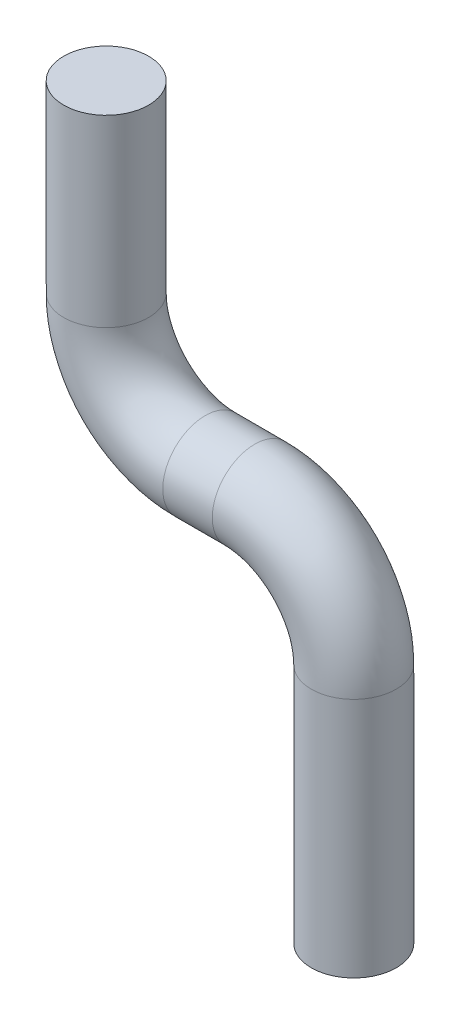
from build123d import *

# Parameters (mm, degrees)
SKETCH_1_R = 6


with BuildPart() as part:
    # По траектории1: sweep along a path in Эскиз2
    with BuildLine(Plane.XY) as sweep_1_path:
        Line((-6, 0), (-6, 34.113207547))
        ThreePointArc((-6, 34.113207547), (-10.100505063, 44.012702484), (-20, 48.113207547))
        Line((-20, 48.113207547), (-27, 48.113207547))
        ThreePointArc((-27, 48.113207547), (-36.899494937, 52.213712611), (-41, 62.113207547))
        Line((-41, 62.113207547), (-41, 88.113207547))
    # Эскиз1 → По траектории1 (sweep)
    with BuildSketch(Plane(origin=(0, 0, 0), x_dir=(1, 0, 0), z_dir=(0, 1, 0))):
        with Locations((-6, 0)):
            Circle(SKETCH_1_R)
    sweep(path=sweep_1_path.line)


solid = part.part
